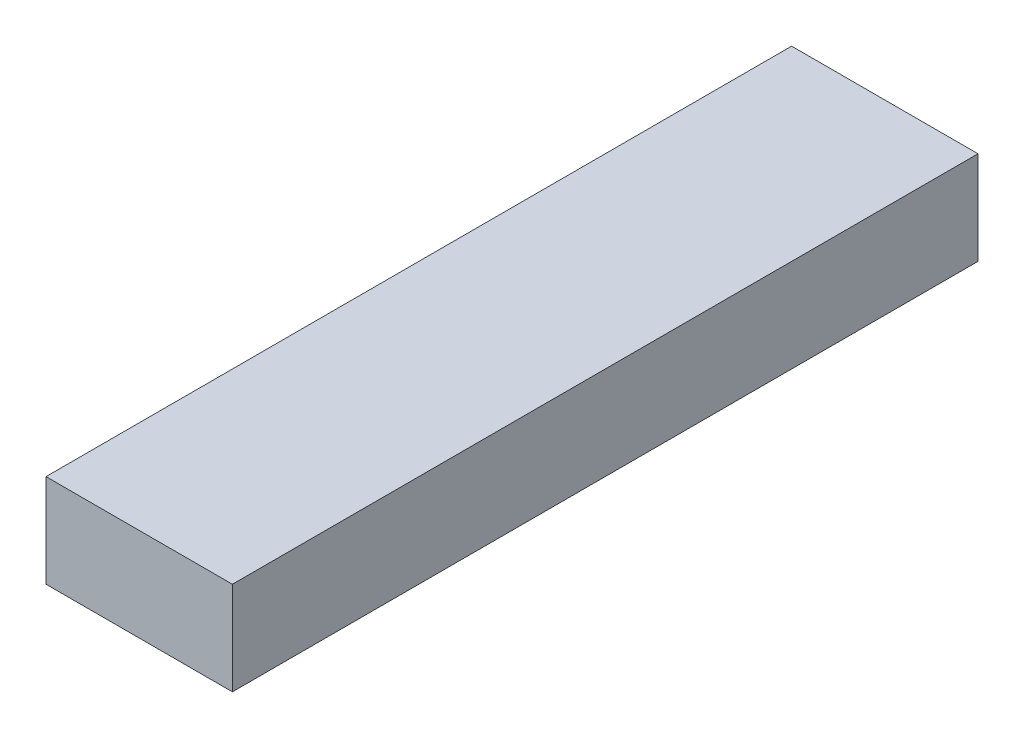
from build123d import *

# Parameters (mm, degrees)
PROFILE1_W = 10
PROFILE1_H = 5


with BuildPart() as part:
    # modern_sweep_merge_false: sweep along a path in Path1
    with BuildLine(Plane(origin=(0, 0, 0), x_dir=(0, 0, -1), z_dir=(1, 0, 0))) as modern_sweep_merge_false_path:
        Line((0, 0), (-40, 0))
    # Profile1 → modern_sweep_merge_false (sweep)
    with BuildSketch(Plane.XY):
        Rectangle(PROFILE1_W, PROFILE1_H)
    sweep(path=modern_sweep_merge_false_path.line)


solid = part.part
